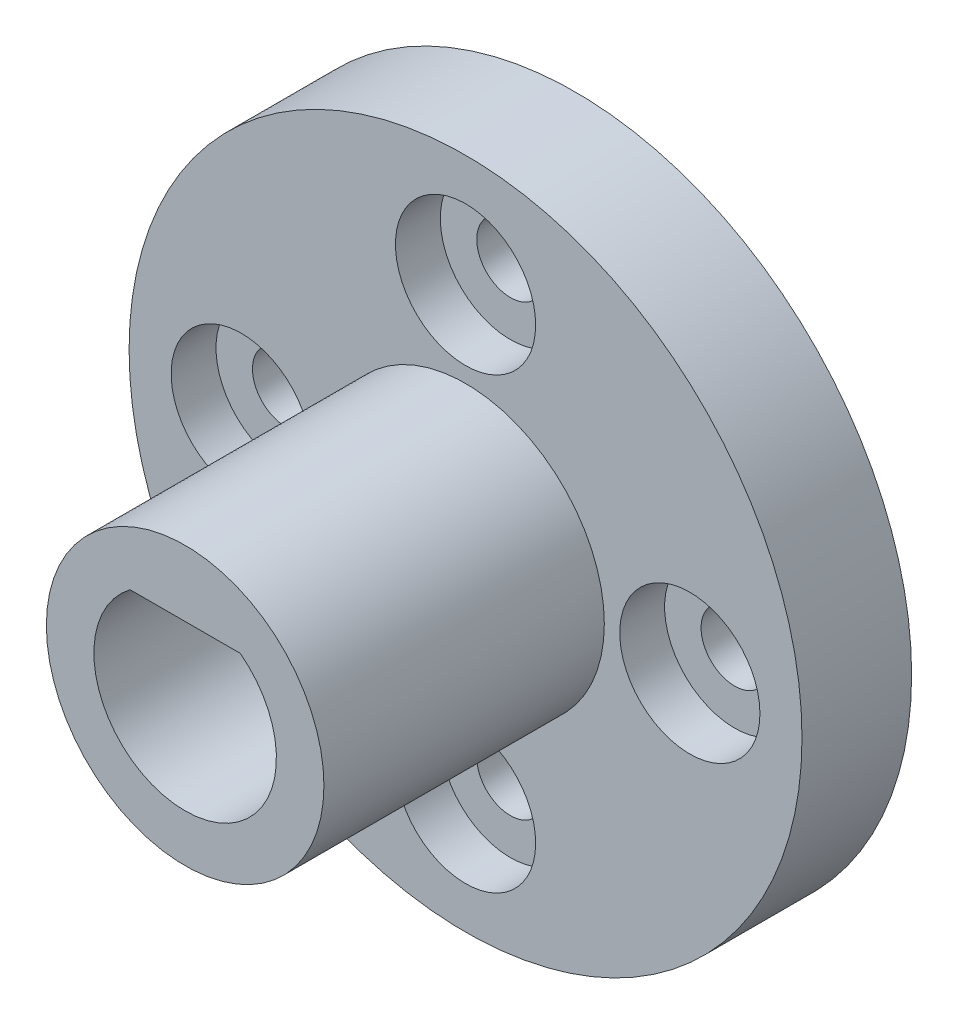
from build123d import *

# Parameters (mm, degrees)
ESQUISSE1_R                                        = 12
BOSS_EXTRU_1_DEPTH                                 = 3.91
ESQUISSE6_R                                        = 4
ENL_V_MAT_EXTRU_2_DEPTH                            = 1.91
ESQUISSE7_R                                        = 4.95
BOSS_EXTRU_2_DEPTH                                 = 10
CHAMBRAGE_POUR_VIS_T_TE_RONDE_BOMB_E_M_D           = 2.4
CHAMBRAGE_POUR_VIS_T_TE_RONDE_BOMB_E_M_CBORE_D     = 5
CHAMBRAGE_POUR_VIS_T_TE_RONDE_BOMB_E_M_CBORE_DEPTH = 1.6
R_P_TITION_CIRCULAIRE2_COUNT                       = 4


with BuildPart() as part:
    # Esquisse1 → Boss.-Extru.1 (new body)
    with BuildSketch(Plane.XY):
        Circle(ESQUISSE1_R)
    extrude(amount=BOSS_EXTRU_1_DEPTH)

    # Esquisse6 → Enlèv. mat.-Extru.2 (cut)
    with BuildSketch(Plane(origin=(0, 0, 0), x_dir=(-1, 0, 0), z_dir=(0, 0, -1))):
        Circle(ESQUISSE6_R)
    extrude(amount=-ENL_V_MAT_EXTRU_2_DEPTH, mode=Mode.SUBTRACT)

    # Esquisse7 → Boss.-Extru.2 (add)
    with BuildSketch(Plane.XY.offset(3.91)):
        Circle(ESQUISSE7_R)
        with BuildLine():
            Line((1.964942747, 2.595), (-1.964942747, 2.595))
            ThreePointArc((-1.964942747, 2.595), (0, -3.255), (1.964942747, 2.595))
        make_face(mode=Mode.SUBTRACT)
    extrude(amount=BOSS_EXTRU_2_DEPTH)

    # Chambrage pour vis à tête ronde bombée M21 (through all)
    with Locations(Plane.XY.offset(3.91)):
        with Locations((0, 8)):
            chambrage_pour_vis_t_te_ronde_bomb_e_m = CounterBoreHole(CHAMBRAGE_POUR_VIS_T_TE_RONDE_BOMB_E_M_D / 2, CHAMBRAGE_POUR_VIS_T_TE_RONDE_BOMB_E_M_CBORE_D / 2, CHAMBRAGE_POUR_VIS_T_TE_RONDE_BOMB_E_M_CBORE_DEPTH)

    # Répétition circulaire2: Chambrage pour vis à tête ronde bombée M21 ×4 about axis
    r_p_tition_circulaire2_axis = Axis((0, 0, 0), (0, 0, 1))
    for i in range(1, R_P_TITION_CIRCULAIRE2_COUNT):
        add(chambrage_pour_vis_t_te_ronde_bomb_e_m.rotate(r_p_tition_circulaire2_axis, i * 360 / R_P_TITION_CIRCULAIRE2_COUNT), mode=Mode.SUBTRACT)


solid = part.part
